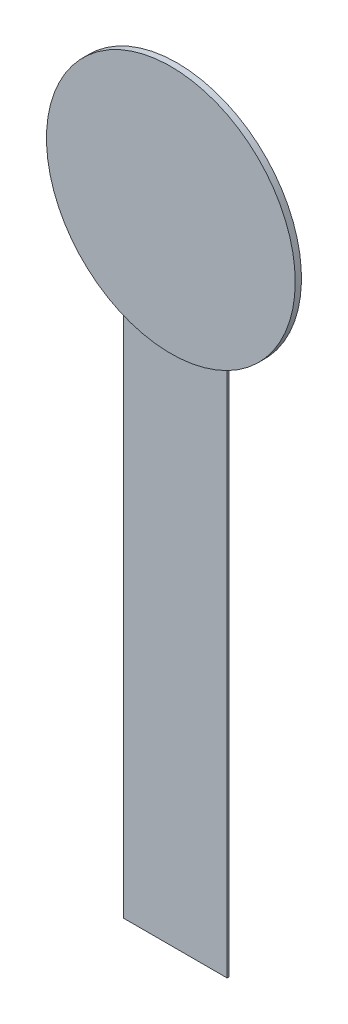
from build123d import *

# Parameters (mm, degrees)
SKETCH1_R           = 9.15
BOSS_EXTRUDE1_DEPTH = 0.46
SKETCH2_W           = 7.62
SKETCH2_H           = 38.870961594
BOSS_EXTRUDE2_DEPTH = 0.13


with BuildPart() as part:
    # Sketch1 → Boss-Extrude1 (new body)
    with BuildSketch(Plane.XY):
        Circle(SKETCH1_R)
    extrude(amount=BOSS_EXTRUDE1_DEPTH)

    # Sketch2 → Boss-Extrude2 (add)
    with BuildSketch(Plane.XY):
        with Locations((0, -27.754519203)):
            Rectangle(SKETCH2_W, SKETCH2_H)
    extrude(amount=BOSS_EXTRUDE2_DEPTH)


solid = part.part
